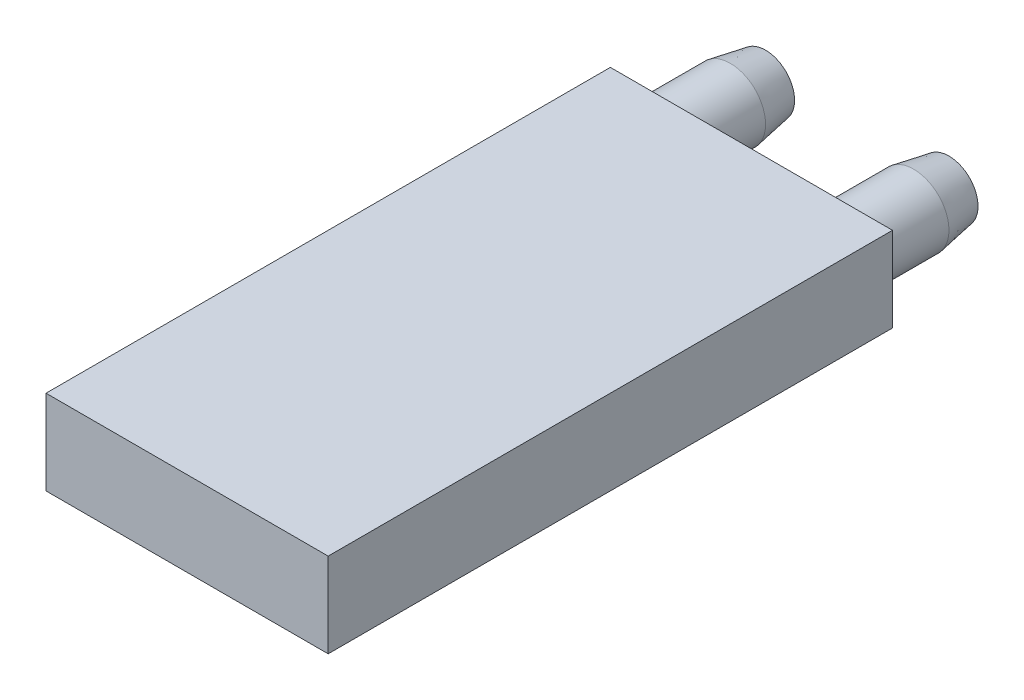
from build123d import *
from OCP.BRepFilletAPI import BRepFilletAPI_MakeChamfer

# Parameters (mm, degrees)
SKETCH1_W           = 40
SKETCH1_H           = 80
BOSS_EXTRUDE1_DEPTH = 6
SKETCH2_R           = 5
BOSS_EXTRUDE2_DEPTH = 15
CHAMFER1_SIZE       = 5
CHAMFER1_SIZE2      = 0.881634904


with BuildPart() as part:
    # Sketch1 → Boss-Extrude1 (new, symmetric)
    with BuildSketch(Plane(origin=(0, 0, 0), x_dir=(1, 0, 0), z_dir=(0, 1, 0))):
        Rectangle(SKETCH1_W, SKETCH1_H)
    extrude(amount=BOSS_EXTRUDE1_DEPTH, both=True)

    # Sketch2 → Boss-Extrude2 (add)
    with BuildSketch(Plane(origin=(0, 0, -40), x_dir=(-1, 0, 0), z_dir=(0, 0, -1))):
        with Locations(Location((13, 0, 0), (0, 0, 180))):
            Circle(SKETCH2_R)
        with Locations(Location((-13, 0, 0), (0, 0, 180))):
            Circle(SKETCH2_R)
    extrude(amount=BOSS_EXTRUDE2_DEPTH)

    # Chamfer1: one chamfer whose edges measure the first distance from different faces: ONE call of the kernel's chamfer builder (chamfer() names one face for all edges)
    chamfer1_edges_1 = [part.edges().sort_by_distance(p)[0] for p in [
        (-18, 0, -55),
    ]]
    chamfer1_side_1 = [part.faces().sort_by_distance(p)[0] for p in [
        (-18, 0, -47.5),
    ]]
    chamfer1_edges_2 = [part.edges().sort_by_distance(p)[0] for p in [
        (8, 0, -55),
    ]]
    chamfer1_side_2 = [part.faces().sort_by_distance(p)[0] for p in [
        (8, 0, -47.5),
    ]]
    chamfer1 = BRepFilletAPI_MakeChamfer(part.part.solid().wrapped)
    for e in chamfer1_edges_1:
        chamfer1.Add(CHAMFER1_SIZE, CHAMFER1_SIZE2, e.wrapped, chamfer1_side_1[0].wrapped)  # the first distance lies on this face
    for e in chamfer1_edges_2:
        chamfer1.Add(CHAMFER1_SIZE, CHAMFER1_SIZE2, e.wrapped, chamfer1_side_2[0].wrapped)  # the first distance lies on this face
    add(Compound.cast(chamfer1.Shape()), mode=Mode.REPLACE)


solid = part.part
